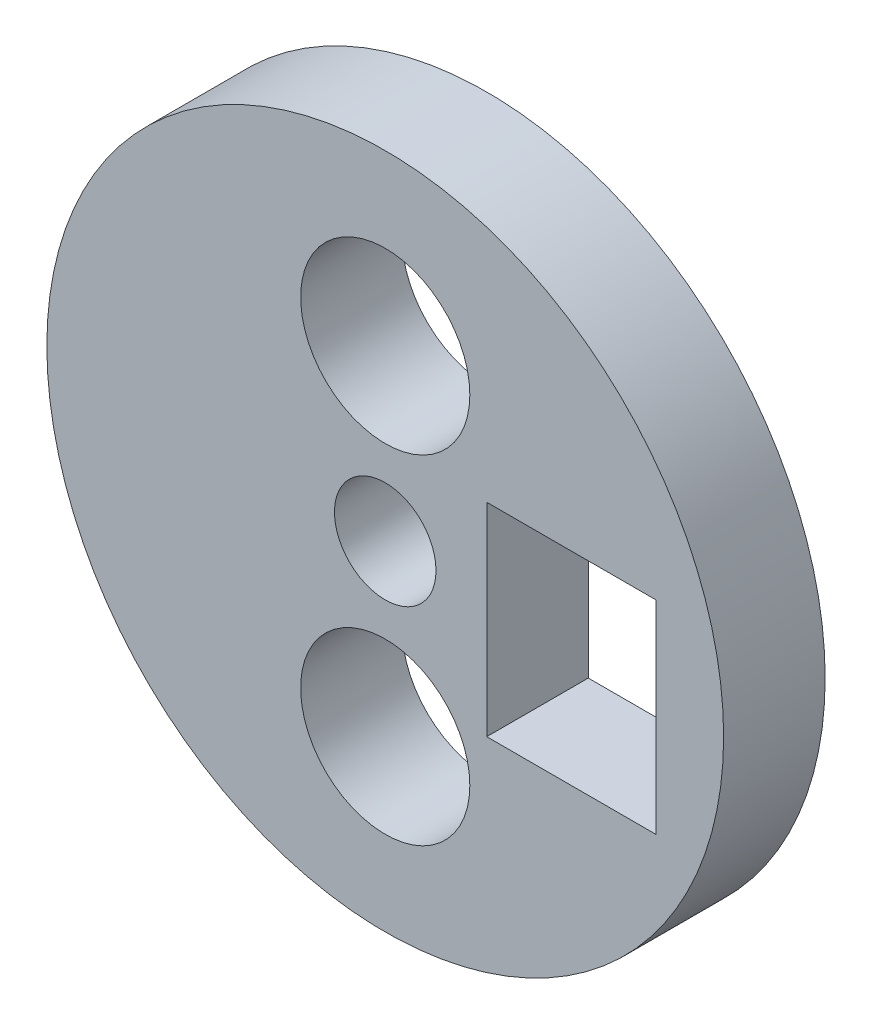
from build123d import *

# Parameters (mm, degrees)
SKETCH1_R           = 10
SKETCH1_R_2         = 2.5
SKETCH1_R_3         = 1.5
BOSS_EXTRUDE1_DEPTH = 3
SKETCH2_W           = 5
SKETCH2_H           = 6
CUT_EXTRUDE1_DEPTH  = 3


with BuildPart() as part:
    # Sketch1 → Boss-Extrude1 (new body)
    with BuildSketch(Plane.XY):
        Circle(SKETCH1_R)
        with Locations((0, 5)):
            Circle(SKETCH1_R_2, mode=Mode.SUBTRACT)
        Circle(SKETCH1_R_3, mode=Mode.SUBTRACT)
        with Locations((0, -5)):
            Circle(SKETCH1_R_2, mode=Mode.SUBTRACT)
    extrude(amount=BOSS_EXTRUDE1_DEPTH)

    # Sketch2 → Cut-Extrude1 (cut)
    with BuildSketch(Plane.XY.offset(3)):
        with Locations((5.5, -0.5)):
            Rectangle(SKETCH2_W, SKETCH2_H)
    extrude(amount=-CUT_EXTRUDE1_DEPTH, mode=Mode.SUBTRACT)


solid = part.part
